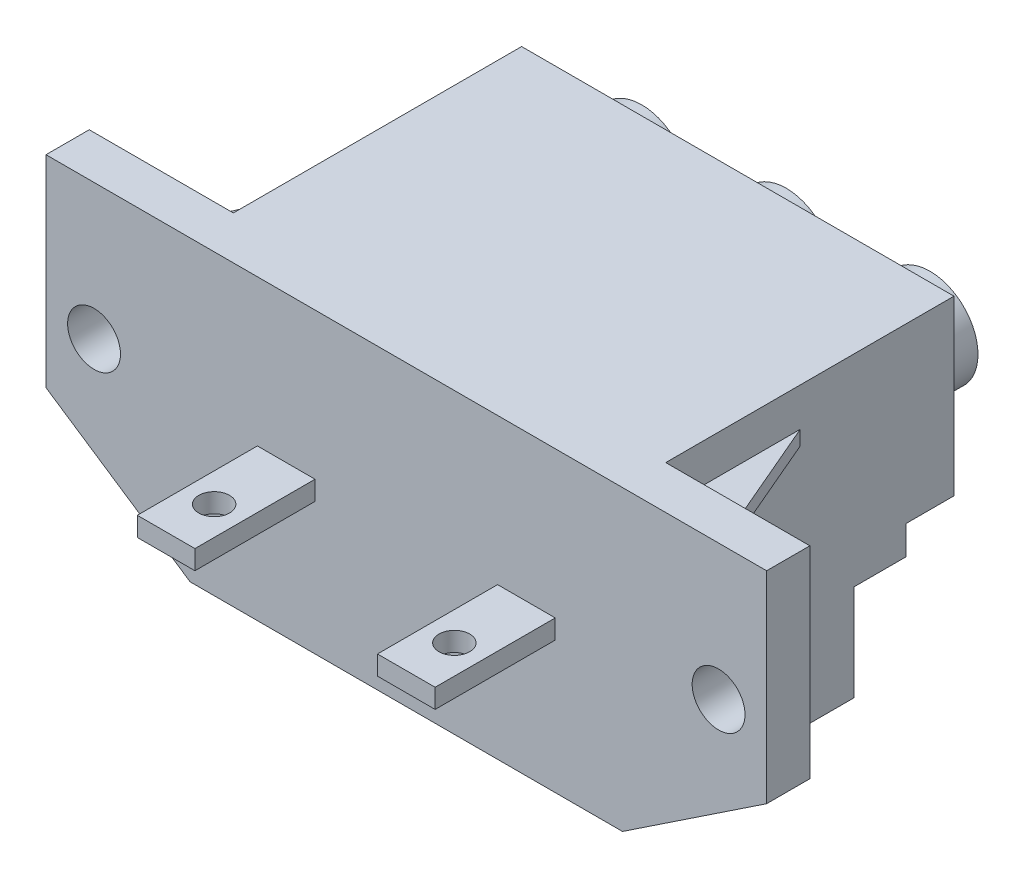
from build123d import *

# Parameters (mm, degrees)
SKETCH_1_R           = 2.75
EXTRUDE_1_DEPTH      = 4.5
EXTRUDE_2_DEPTH      = 22.5
EXTRUDE_2_DEPTH_BACK = 22.5
SKETCH_3_R           = 5
SKETCH_3_R_2         = 3.5
EXTRUDE_3_DEPTH      = 5
SKETCH_4_W           = 10
SKETCH_4_H           = 15
CUT_EXTRUDE_1_DEPTH  = 5
SKETCH_5_W           = 6
SKETCH_5_H           = 2
EXTRUDE_4_DEPTH      = 12.5
SKETCH_6_W           = 6
SKETCH_6_H           = 1.5
EXTRUDE_5_DEPTH      = 14
CUT_EXTRUDE_2_DEPTH  = 20
SKETCH_8_R           = 1.6
CUT_EXTRUDE_3_DEPTH  = 10


with BuildPart() as part:
    # Эскиз1 → Вытянуть1 (new body)
    with BuildSketch(Plane.XY):
        Polygon((-22.5, -16.9), (-37.5, -6.9), (-37.5, 14.1), (37.5, 14.1), (37.5, -6.9), (22.5, -16.9), align=None)
        with Locations((-32.5, 0)):
            Circle(SKETCH_1_R, mode=Mode.SUBTRACT)
        with Locations((32.5, 0)):
            Circle(SKETCH_1_R, mode=Mode.SUBTRACT)
    extrude(amount=EXTRUDE_1_DEPTH)

    # Эскиз2 → Вытянуть2 (add, two sides: drawn at the far end of the back side and taken through both)
    with BuildSketch(Plane(origin=(0, 0, 0), x_dir=(0, 0, -1), z_dir=(1, 0, 0)).offset(-EXTRUDE_2_DEPTH_BACK)):
        Polygon((0, -16.9), (19.60451018, -16.9), (19.60451018, -6.9), (25, -6.9), (25, -3.9), (30, -3.9), (30, 14.1), (0, 14.1), align=None)
    extrude(amount=EXTRUDE_2_DEPTH + EXTRUDE_2_DEPTH_BACK)

    # Эскиз3 → Вытянуть3 (add)
    # profile 1 of 3: a face of its own
    with BuildSketch(Plane(origin=(0, 0, -30), x_dir=(-1, 0, 0), z_dir=(0, 0, -1))):
        with Locations(Location((-15, 5.1, 0), (0, 0, 180))):
            Circle(SKETCH_3_R)
        with Locations((-15, 5.1)):
            Circle(SKETCH_3_R_2, mode=Mode.SUBTRACT)
    # profile 2 of 3: a face of its own
    with BuildSketch(Plane(origin=(0, 0, -30), x_dir=(-1, 0, 0), z_dir=(0, 0, -1))):
        with Locations(Location((15, 5.1, 0), (0, 0, 180))):
            Circle(SKETCH_3_R)
        with Locations((15, 5.1)):
            Circle(SKETCH_3_R_2, mode=Mode.SUBTRACT)
    # profile 3 of 3: a face of its own
    with BuildSketch(Plane(origin=(0, 0, -30), x_dir=(-1, 0, 0), z_dir=(0, 0, -1))):
        with Locations(Location((-0.042603982, 5.1, 0), (0, 0, 180))):
            Circle(SKETCH_3_R)
        with Locations((-0.042603982, 5.1)):
            Circle(SKETCH_3_R_2, mode=Mode.SUBTRACT)
    extrude(amount=EXTRUDE_3_DEPTH)

    # Эскиз4 → Вырез-Вытянуть1 (cut)
    with BuildSketch(Plane.XZ.offset(16.9)):
        with Locations((0, -7.55225509)):
            Rectangle(SKETCH_4_W, SKETCH_4_H)
        with Locations((12.5, -7.55225509)):
            Rectangle(SKETCH_4_W, SKETCH_4_H)
        with Locations((-12.5, -7.55225509)):
            Rectangle(SKETCH_4_W, SKETCH_4_H)
    extrude(amount=-CUT_EXTRUDE_1_DEPTH, mode=Mode.SUBTRACT)

    # Эскиз5 → Вытянуть4 (add)
    with BuildSketch(Plane.XY.offset(4.5)):
        with Locations((-12.5, -2.15)):
            Rectangle(SKETCH_5_W, SKETCH_5_H)
        with Locations((12.5, -2.15)):
            Rectangle(SKETCH_5_W, SKETCH_5_H)
    extrude(amount=EXTRUDE_4_DEPTH)

    # Эскиз6 → Вытянуть5 (add)
    with BuildSketch(Plane(origin=(0, 0, 0), x_dir=(-1, 0, 0), z_dir=(0, 0, -1))):
        with Locations((-25.5, -8.15)):
            Rectangle(SKETCH_6_W, SKETCH_6_H)
        with Locations((-25.5, 9.35)):
            Rectangle(SKETCH_6_W, SKETCH_6_H)
        with Locations((25.5, 9.35)):
            Rectangle(SKETCH_6_W, SKETCH_6_H)
        with Locations((25.5, -8.15)):
            Rectangle(SKETCH_6_W, SKETCH_6_H)
    extrude(amount=EXTRUDE_5_DEPTH)

    # Эскиз7 → Вырез-Вытянуть2 (cut)
    with BuildSketch(Plane.XZ.offset(8.9)):
        Polygon((-22.5, -14), (-28.5, -14), (-28.5, 0), align=None)
        Polygon((22.5, -14), (28.5, 0), (28.5, -14), align=None)
    extrude(amount=-CUT_EXTRUDE_2_DEPTH, mode=Mode.SUBTRACT)

    # Эскиз8 → Вырез-Вытянуть3 (cut)
    with BuildSketch(Plane.XZ.offset(3.15)):
        with Locations((-12.5, 12)):
            Circle(SKETCH_8_R)
        with Locations((12.5, 12)):
            Circle(SKETCH_8_R)
    extrude(amount=-CUT_EXTRUDE_3_DEPTH, mode=Mode.SUBTRACT)


solid = part.part
